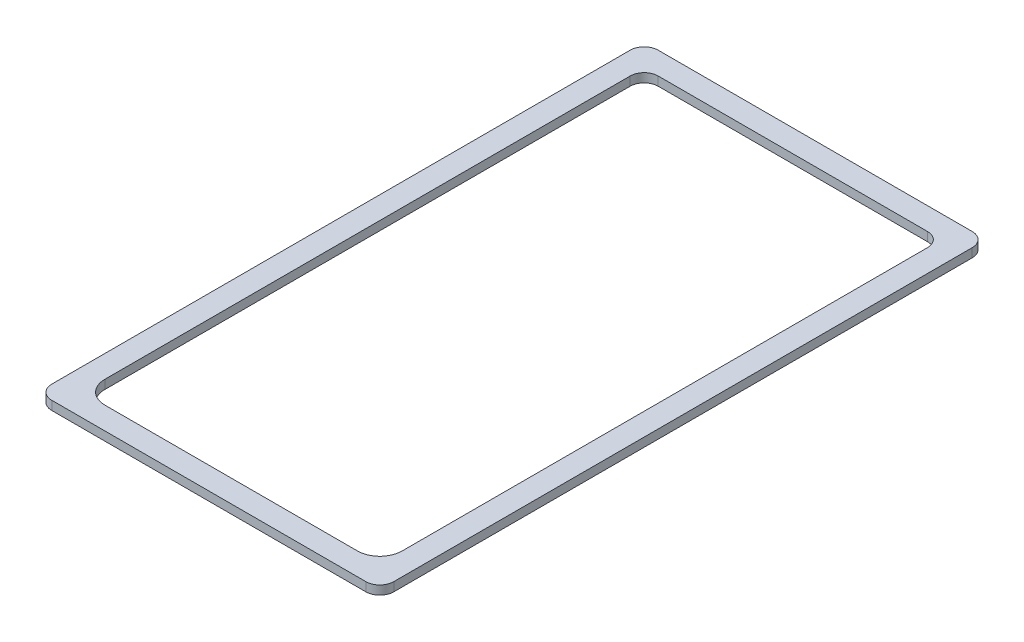
from build123d import *

# Parameters (mm, degrees)
BOSS_EXTRUDE1_DEPTH = 1.5875


with BuildPart() as part:
    # Sketch1 → Boss-Extrude1 (new body)
    with BuildSketch(Plane(origin=(0, 0, 0), x_dir=(1, 0, 0), z_dir=(0, 1, 0))):
        with BuildLine():
            Line((28.1, -54.25), (-28.1, -54.25))
            ThreePointArc((-28.1, -54.25), (-29.867766953, -53.517766953), (-30.6, -51.75))
            Line((-30.6, -51.75), (-30.6, 51.75))
            ThreePointArc((-30.6, 51.75), (-29.867766953, 53.517766953), (-28.1, 54.25))
            Line((-28.1, 54.25), (28.1, 54.25))
            ThreePointArc((28.1, 54.25), (29.867766953, 53.517766953), (30.6, 51.75))
            Line((30.6, 51.75), (30.6, -51.75))
            ThreePointArc((30.6, -51.75), (29.867766953, -53.517766953), (28.1, -54.25))
        make_face()
        with BuildLine():
            Line((22.6, -50.25), (-22.6, -50.25))
            ThreePointArc((-22.6, -50.25), (-25.428427125, -49.078427125), (-26.6, -46.25))
            Line((-26.6, -46.25), (-26.6, 47.75))
            ThreePointArc((-26.6, 47.75), (-25.867766953, 49.517766953), (-24.1, 50.25))
            Line((-24.1, 50.25), (24.1, 50.25))
            ThreePointArc((24.1, 50.25), (25.867766953, 49.517766953), (26.6, 47.75))
            Line((26.6, 47.75), (26.6, -46.25))
            ThreePointArc((26.6, -46.25), (25.428427125, -49.078427125), (22.6, -50.25))
        make_face(mode=Mode.SUBTRACT)
    extrude(amount=BOSS_EXTRUDE1_DEPTH)


solid = part.part
